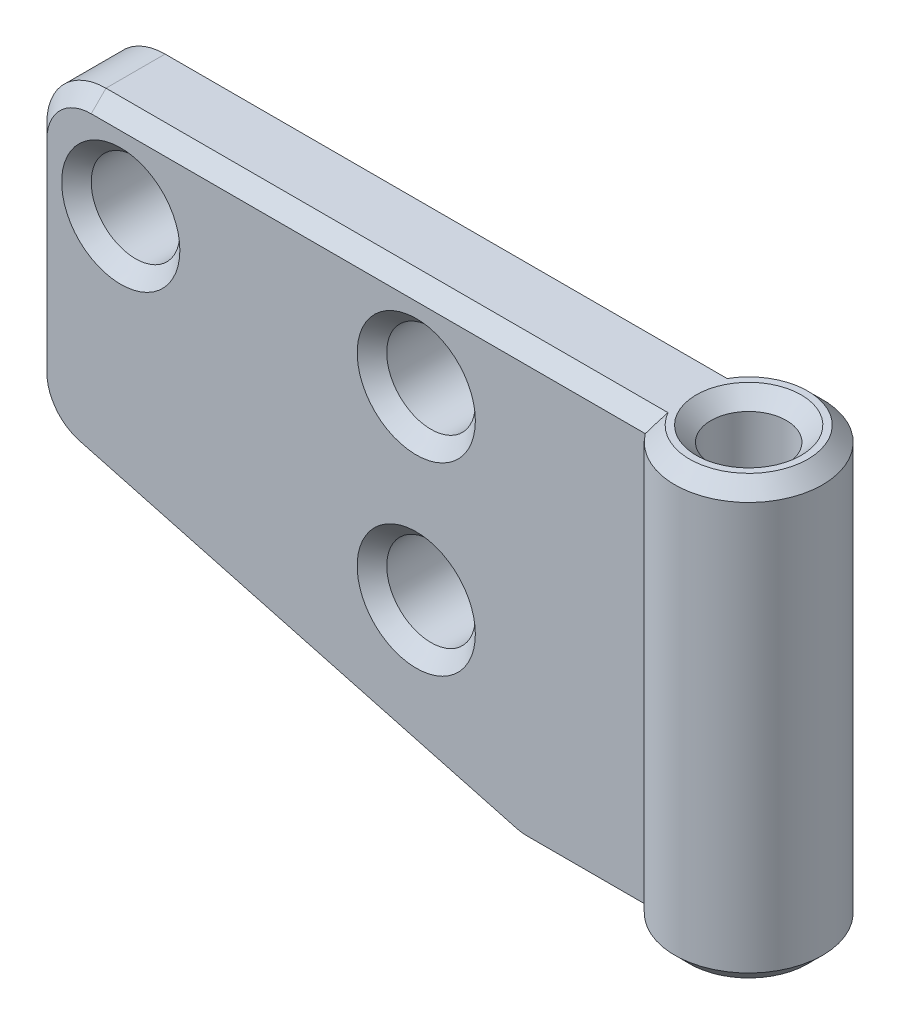
from build123d import *

# Parameters (mm, degrees)
SKETCH_2_R          = 3
EXTRUDE_1_DEPTH     = 6
SKETCH_3_R          = 5
EXTRUDE_2_DEPTH     = 29.58
SKETCH_4_R          = 2.55
CUT_EXTRUDE_1_DEPTH = 55.029865815
CHAMFER_1_SIZE      = 1


with BuildPart() as part:
    # 草图2 → 凸台-拉伸1 (new body)
    with BuildSketch(Plane.XY):
        with BuildLine():
            Line((26.49133381, -23.443703305), (-3.03527618, -15.532072003))
            ThreePointArc((-3.03527618, -15.532072003), (-5.173413361, -14.103414414), (-6, -11.668368698))
            Line((-6, -11.668368698), (-6, 2))
            ThreePointArc((-6, 2), (-4.828427125, 4.828427125), (-2, 6))
            Line((-2, 6), (39.5, 6))
            Line((39.5, 6), (39.5, -23.58))
            Line((39.5, -23.58), (27.52660999, -23.58))
            ThreePointArc((27.52660999, -23.58), (27.004505221, -23.545779445), (26.49133381, -23.443703305))
        make_face()
        Circle(SKETCH_2_R, mode=Mode.SUBTRACT)
        with Locations((20, 0)):
            Circle(SKETCH_2_R, mode=Mode.SUBTRACT)
        with Locations((20, -12.5)):
            Circle(SKETCH_2_R, mode=Mode.SUBTRACT)
    extrude(amount=EXTRUDE_1_DEPTH)

    # 草图3 → 凸台-拉伸2 (add, through all)
    with BuildSketch(Plane(origin=(0, 6, 0), x_dir=(1, 0, 0), z_dir=(0, 1, 0))):
        with Locations((39.5, -3)):
            Circle(SKETCH_3_R)
    extrude(amount=-EXTRUDE_2_DEPTH)

    # 草图4 → 切除-拉伸1 (cut, through all)
    with BuildSketch(Plane(origin=(0, 6, 0), x_dir=(1, 0, 0), z_dir=(0, 1, 0))):
        with Locations(Location((39.5, -3, 0), (0, 0, 270))):
            Circle(SKETCH_4_R)
    extrude(amount=-CUT_EXTRUDE_1_DEPTH, mode=Mode.SUBTRACT)

    # 倒角1
    chamfer_1_edges = [part.edges().sort_by_distance(p)[0] for p in [
        (31.513304995, -23.58, 0),
        (27.004505221, -23.545779445, 0),
        (-4.828427125, 4.828427125, 6),
        (-3, 0, 0),
        (-3, 0, 6),
        (-6, -4.834184349, 6),
        (17, 0, 0),
        (17, 0, 6),
        (-5.173413361, -14.103414414, 6),
        (17, -12.5, 0),
        (17, -12.5, 6),
        (11.728028815, -19.487887654, 6),
        (16.75, 6, 0),
        (16.75, 6, 6),
        (44.5, -23.58, 3),
        (44.5, 6, 3),
        (27.004505221, -23.545779445, 6),
        (39.5, 6, 0.45),
        (11.728028815, -19.487887654, 0),
        (31.513304995, -23.58, 6),
        (-5.173413361, -14.103414414, 0),
        (-6, -4.834184349, 0),
        (-4.828427125, 4.828427125, 0),
    ]]
    chamfer(chamfer_1_edges, length=CHAMFER_1_SIZE)


solid = part.part
